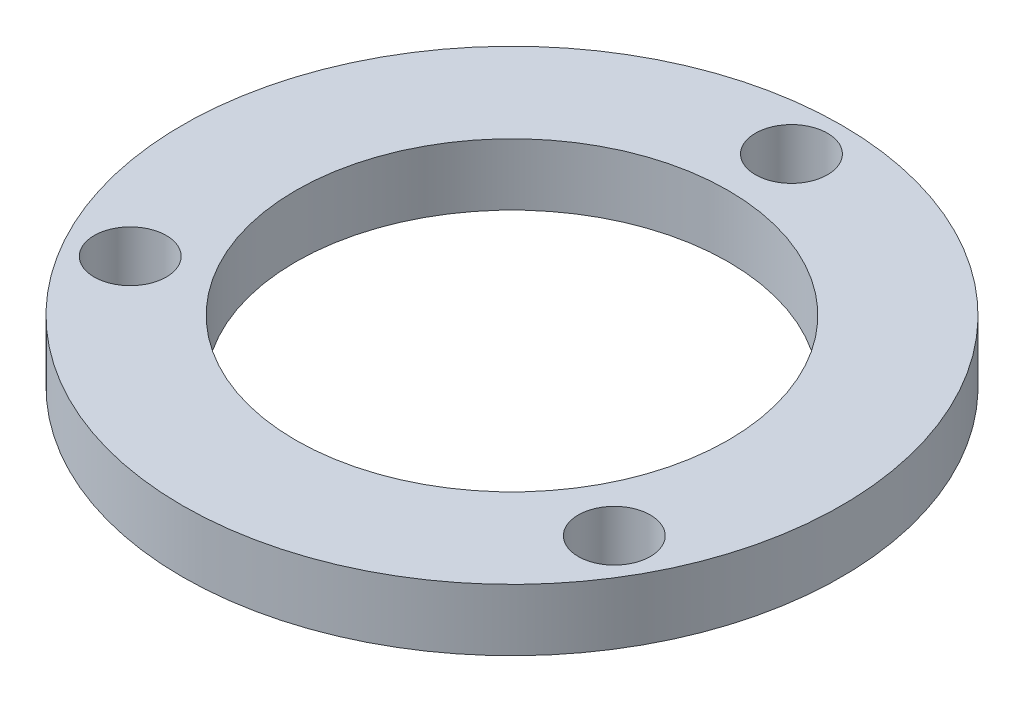
from build123d import *

# Parameters (mm, degrees)
SKETCH1_R           = 16
SKETCH1_R_2         = 10.5
BOSS_EXTRUDE1_DEPTH = 3
SKETCH2_R           = 1.75
CUT_EXTRUDE1_DEPTH  = 23.825424421


with BuildPart() as part:
    # Sketch1 → Boss-Extrude1 (new body)
    with BuildSketch(Plane(origin=(0, 0, 0), x_dir=(1, 0, 0), z_dir=(0, 1, 0))):
        with Locations(Location((0, 0, 0), (0, 0, 270))):
            Circle(SKETCH1_R)
        with Locations(Location((0, 0, 0), (0, 0, 270))):
            Circle(SKETCH1_R_2, mode=Mode.SUBTRACT)
    extrude(amount=BOSS_EXTRUDE1_DEPTH)

    # Sketch2 → Cut-Extrude1 (cut, through all)
    with BuildSketch(Plane(origin=(0, 3, 0), x_dir=(1, 0, 0), z_dir=(0, 1, 0))):
        with Locations(Location((0, 13.567731326, 0), (0, 0, 270))):
            Circle(SKETCH2_R)
        with Locations(Location((-11.75, -6.783865663, 0), (0, 0, 270))):
            Circle(SKETCH2_R)
        with Locations(Location((11.75, -6.783865663, 0), (0, 0, 270))):
            Circle(SKETCH2_R)
    extrude(amount=-CUT_EXTRUDE1_DEPTH, mode=Mode.SUBTRACT)


solid = part.part
